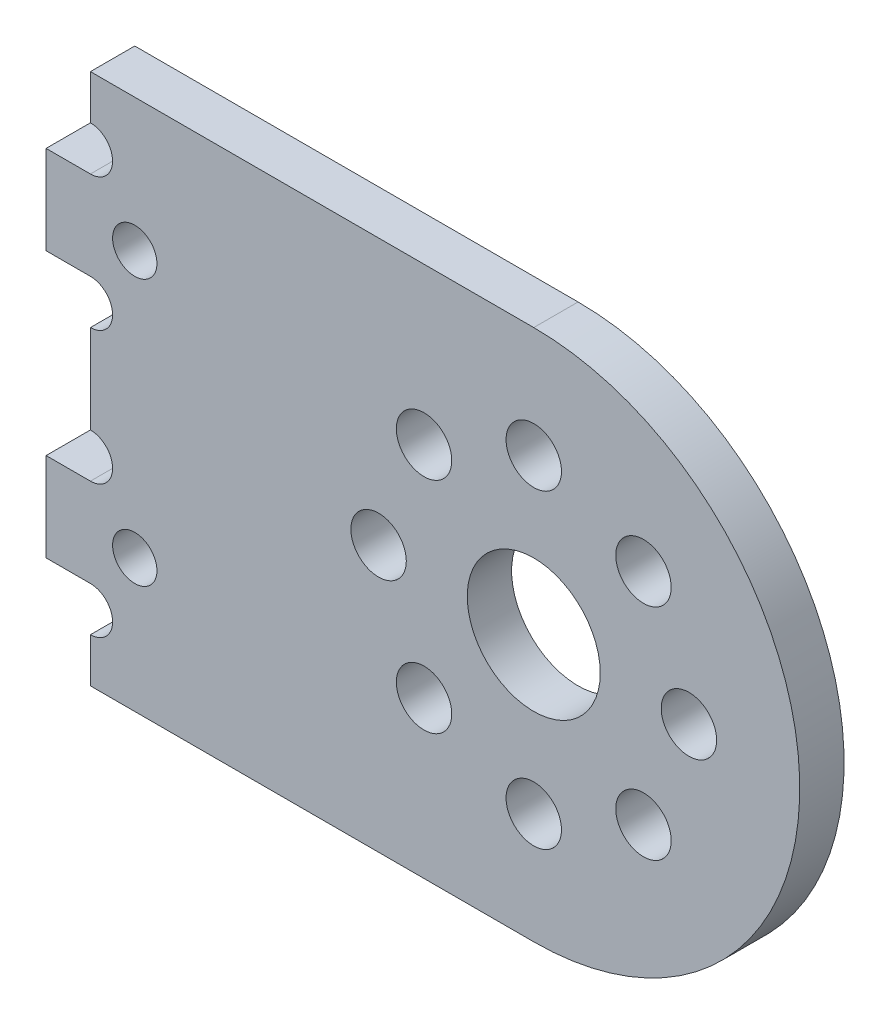
from build123d import *

# Parameters (mm, degrees)
SKETCH_8_R      = 1.25
SKETCH_8_R_2    = 3
SKETCH_8_R_3    = 1
EXTRUDE_1_DEPTH = 2


with BuildPart() as part:
    # 草圖8 → 填料-伸長1 (new body)
    with BuildSketch(Plane.XY):
        with BuildLine():
            Line((-23.40478598, 11.861352689), (-23.40478598, 9.861352689))
            ThreePointArc((-23.40478598, 9.861352689), (-22.40478598, 8.861352689), (-23.40478598, 7.861352689))
            Line((-23.40478598, 7.861352689), (-25.40478598, 7.861352689))
            Line((-25.40478598, 7.861352689), (-25.40478598, 3.861352689))
            Line((-25.40478598, 3.861352689), (-23.40478598, 3.861352689))
            ThreePointArc((-23.40478598, 3.861352689), (-22.40478598, 2.861352689), (-23.40478598, 1.861352689))
            Line((-23.40478598, 1.861352689), (-23.40478598, -2.138647311))
            ThreePointArc((-23.40478598, -2.138647311), (-22.40478598, -3.138647311), (-23.40478598, -4.138647311))
            Line((-23.40478598, -4.138647311), (-25.40478598, -4.138647311))
            Line((-25.40478598, -4.138647311), (-25.40478598, -8.138647311))
            Line((-25.40478598, -8.138647311), (-23.40478598, -8.138647311))
            ThreePointArc((-23.40478598, -8.138647311), (-22.40478598, -9.138647311), (-23.40478598, -10.138647311))
            Line((-23.40478598, -10.138647311), (-23.40478598, -12.138647311))
            Line((-23.40478598, -12.138647311), (-3.40478598, -12.138647311))
            ThreePointArc((-3.40478598, -12.138647311), (8.59521402, -0.138647311), (-3.40478598, 11.861352689))
            Line((-3.40478598, 11.861352689), (-23.40478598, 11.861352689))
        make_face()
        with Locations((-3.40478598, 6.861352689)):
            Circle(SKETCH_8_R, mode=Mode.SUBTRACT)
        with Locations((1.544961489, 4.811100157)):
            Circle(SKETCH_8_R, mode=Mode.SUBTRACT)
        with Locations((-3.40478598, -0.138647311)):
            Circle(SKETCH_8_R_2, mode=Mode.SUBTRACT)
        with Locations((3.59521402, -0.138647311)):
            Circle(SKETCH_8_R, mode=Mode.SUBTRACT)
        with Locations((1.544961489, -5.08839478)):
            Circle(SKETCH_8_R, mode=Mode.SUBTRACT)
        with Locations((-3.40478598, -7.138647311)):
            Circle(SKETCH_8_R, mode=Mode.SUBTRACT)
        with Locations((-8.354533448, -5.08839478)):
            Circle(SKETCH_8_R, mode=Mode.SUBTRACT)
        with Locations((-10.40478598, -0.138647311)):
            Circle(SKETCH_8_R, mode=Mode.SUBTRACT)
        with Locations((-8.354533448, 4.811100157)):
            Circle(SKETCH_8_R, mode=Mode.SUBTRACT)
        with Locations((-21.40478598, 5.861352689)):
            Circle(SKETCH_8_R_3, mode=Mode.SUBTRACT)
        with Locations((-21.40478598, -6.138647311)):
            Circle(SKETCH_8_R_3, mode=Mode.SUBTRACT)
    extrude(amount=EXTRUDE_1_DEPTH)


solid = part.part
